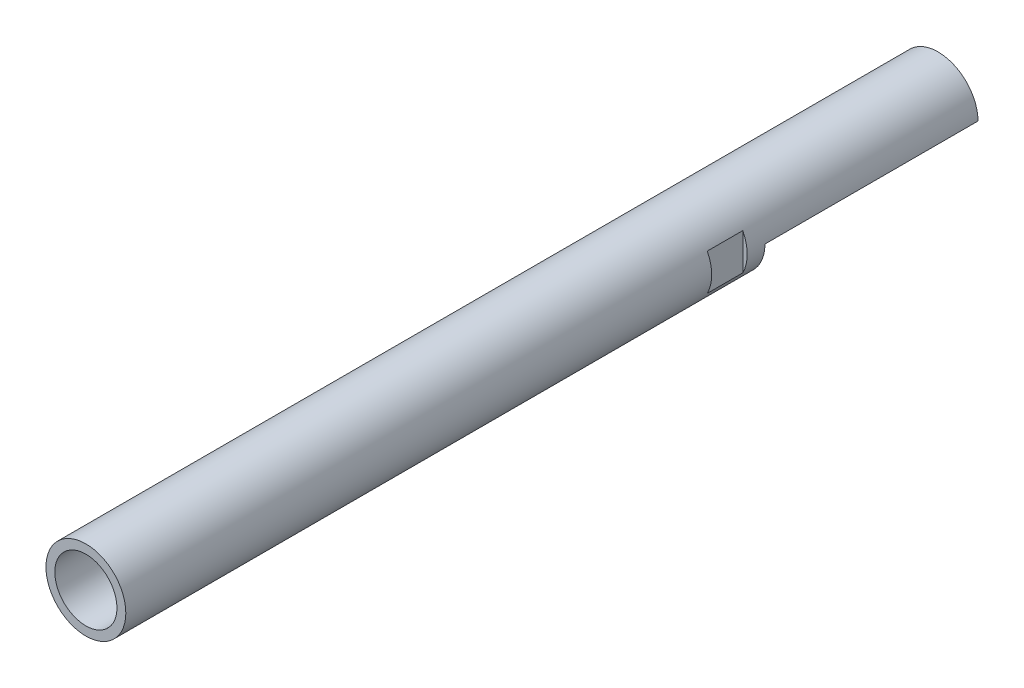
from build123d import *

# Parameters (mm, degrees)
SKETCH1_R                           = 14.2875
SKETCH1_R_2                         = 9.525
BOSS_EXTRUDE1_DEPTH                 = 304.8
SKETCH2_R                           = 11.1125
CUT_EXTRUDE1_DEPTH                  = 19.05
CUT_EXTRUDE4_DEPTH                  = 76.2
CUT_EXTRUDE7_DEPTH                  = 12.7
CUT_EXTRUDE8_REACH                  = 308.326
CUT_EXTRUDE8_END_RADIUS             = 9.525
CUT_EXTRUDE8_DIRECTION_2_REACH      = 308.326
CUT_EXTRUDE8_DIRECTION_2_END_RADIUS = 14.2875


with BuildPart() as part:
    # Sketch1 → Boss-Extrude1 (new body)
    with BuildSketch(Plane.XY):
        with Locations(Location((0, 0, 0), (0, 0, 180))):
            Circle(SKETCH1_R)
        with Locations(Location((0, 0, 0), (0, 0, 180))):
            Circle(SKETCH1_R_2, mode=Mode.SUBTRACT)
    extrude(amount=BOSS_EXTRUDE1_DEPTH)

    # Sketch2 → Cut-Extrude1 (cut)
    with BuildSketch(Plane.XY.offset(304.8)):
        Circle(SKETCH2_R)
    extrude(amount=-CUT_EXTRUDE1_DEPTH, mode=Mode.SUBTRACT)

    # Sketch6 → Cut-Extrude4 (cut)
    with BuildSketch(Plane(origin=(0, 0, 0), x_dir=(-1, 0, 0), z_dir=(0, 0, -1))):
        with BuildLine():
            Line((14.2875, 0), (-14.2875, 0))
            ThreePointArc((-14.2875, 0), (0, -14.2875), (14.2875, 0))
        make_face()
    extrude(amount=-CUT_EXTRUDE4_DEPTH, mode=Mode.SUBTRACT)

    # Sketch8 → Cut-Extrude7 (cut)
    with BuildSketch(Plane(origin=(0, 0, 82.55), x_dir=(-1, 0, 0), z_dir=(0, 0, -1))):
        with BuildLine():
            ThreePointArc((-6.545430181, -12.7), (0, -14.2875), (6.545430181, -12.7))
            Line((6.545430181, -12.7), (-6.545430181, -12.7))
        make_face()
        with BuildLine():
            Line((-12.7, -6.545430181), (-12.7, 6.545430181))
            ThreePointArc((-12.7, 6.545430181), (-14.2875, 0), (-12.7, -6.545430181))
        make_face()
    extrude(amount=-CUT_EXTRUDE7_DEPTH, mode=Mode.SUBTRACT)

    # Cut-Extrude8: up to this cylinder (the profile starts outside it)
    cut_extrude8_end = Plane(origin=(0, 0, 171.45), z_dir=(0, 0, -1)) * Cylinder(CUT_EXTRUDE8_END_RADIUS, 636.702, mode=Mode.PRIVATE)
    # Sketch9 → Cut-Extrude8 (cut, up to the surface)
    with BuildSketch(Plane.XZ.offset(12.7), mode=Mode.PRIVATE) as cut_extrude8_sk1:
        with BuildLine():
            ThreePointArc((0, 174.625), (-3.175, 171.45), (0, 168.275))
            Line((0, 168.275), (0, 174.625))
        make_face()
    cut_extrude8_tool1 = extrude(cut_extrude8_sk1.sketch, amount=-CUT_EXTRUDE8_REACH, mode=Mode.PRIVATE) - cut_extrude8_end
    add(cut_extrude8_tool1.solids().sort_by_distance((-1.347512, -12.7, 171.45))[0], mode=Mode.SUBTRACT)
    # Sketch9 → Cut-Extrude8 (cut, up to the surface)
    with BuildSketch(Plane.XZ.offset(12.7), mode=Mode.PRIVATE) as cut_extrude8_sk2:
        with BuildLine():
            Line((0, 174.625), (0, 168.275))
            ThreePointArc((0, 168.275), (2.24506403, 169.20493597), (3.175, 171.45))
            ThreePointArc((3.175, 171.45), (2.24506403, 173.69506403), (0, 174.625))
        make_face()
    cut_extrude8_tool2 = extrude(cut_extrude8_sk2.sketch, amount=-CUT_EXTRUDE8_REACH, mode=Mode.PRIVATE) - cut_extrude8_end
    add(cut_extrude8_tool2.solids().sort_by_distance((1.347512, -12.7, 171.45))[0], mode=Mode.SUBTRACT)
    # Sketch9 → Cut-Extrude8 (cut, up to the surface)
    with BuildSketch(Plane.XZ.offset(12.7), mode=Mode.PRIVATE) as cut_extrude8_sk3:
        with BuildLine():
            ThreePointArc((0, 174.625), (-3.175, 171.45), (0, 168.275))
            Line((0, 168.275), (0, 174.625))
        make_face()
    cut_extrude8_tool3 = extrude(cut_extrude8_sk3.sketch, amount=-CUT_EXTRUDE8_REACH, mode=Mode.PRIVATE) - cut_extrude8_end
    add(cut_extrude8_tool3.solids().sort_by_distance((-1.347512, -12.7, 171.45))[0], mode=Mode.SUBTRACT)
    # Sketch9 → Cut-Extrude8 (cut, up to the surface)
    with BuildSketch(Plane.XZ.offset(12.7), mode=Mode.PRIVATE) as cut_extrude8_sk4:
        with BuildLine():
            Line((0, 174.625), (0, 168.275))
            ThreePointArc((0, 168.275), (2.24506403, 169.20493597), (3.175, 171.45))
            ThreePointArc((3.175, 171.45), (2.24506403, 173.69506403), (0, 174.625))
        make_face()
    cut_extrude8_tool4 = extrude(cut_extrude8_sk4.sketch, amount=-CUT_EXTRUDE8_REACH, mode=Mode.PRIVATE) - cut_extrude8_end
    add(cut_extrude8_tool4.solids().sort_by_distance((1.347512, -12.7, 171.45))[0], mode=Mode.SUBTRACT)

    # Cut-Extrude8 direction 2: up to this cylinder (the profile starts inside it)
    cut_extrude8_direction_2_end = Plane(origin=(0, 0, 171.45), z_dir=(0, 0, -1)) * Cylinder(CUT_EXTRUDE8_DIRECTION_2_END_RADIUS, 646.227, mode=Mode.PRIVATE)
    # Sketch9 → Cut-Extrude8 direction 2 (cut, up to the surface)
    with BuildSketch(Plane.XZ.offset(12.7), mode=Mode.PRIVATE) as cut_extrude8_direction_2_sk1:
        with BuildLine():
            ThreePointArc((0, 174.625), (-3.175, 171.45), (0, 168.275))
            Line((0, 168.275), (0, 174.625))
        make_face()
    cut_extrude8_direction_2_tool1 = extrude(cut_extrude8_direction_2_sk1.sketch, amount=CUT_EXTRUDE8_DIRECTION_2_REACH, mode=Mode.PRIVATE) & cut_extrude8_direction_2_end
    add(cut_extrude8_direction_2_tool1.solids().sort_by_distance((-1.347512, -12.7, 171.45))[0], mode=Mode.SUBTRACT)
    # Sketch9 → Cut-Extrude8 direction 2 (cut, up to the surface)
    with BuildSketch(Plane.XZ.offset(12.7), mode=Mode.PRIVATE) as cut_extrude8_direction_2_sk2:
        with BuildLine():
            Line((0, 174.625), (0, 168.275))
            ThreePointArc((0, 168.275), (2.24506403, 169.20493597), (3.175, 171.45))
            ThreePointArc((3.175, 171.45), (2.24506403, 173.69506403), (0, 174.625))
        make_face()
    cut_extrude8_direction_2_tool2 = extrude(cut_extrude8_direction_2_sk2.sketch, amount=CUT_EXTRUDE8_DIRECTION_2_REACH, mode=Mode.PRIVATE) & cut_extrude8_direction_2_end
    add(cut_extrude8_direction_2_tool2.solids().sort_by_distance((1.347512, -12.7, 171.45))[0], mode=Mode.SUBTRACT)
    # Sketch9 → Cut-Extrude8 direction 2 (cut, up to the surface)
    with BuildSketch(Plane.XZ.offset(12.7), mode=Mode.PRIVATE) as cut_extrude8_direction_2_sk3:
        with BuildLine():
            ThreePointArc((0, 174.625), (-3.175, 171.45), (0, 168.275))
            Line((0, 168.275), (0, 174.625))
        make_face()
    cut_extrude8_direction_2_tool3 = extrude(cut_extrude8_direction_2_sk3.sketch, amount=CUT_EXTRUDE8_DIRECTION_2_REACH, mode=Mode.PRIVATE) & cut_extrude8_direction_2_end
    add(cut_extrude8_direction_2_tool3.solids().sort_by_distance((-1.347512, -12.7, 171.45))[0], mode=Mode.SUBTRACT)
    # Sketch9 → Cut-Extrude8 direction 2 (cut, up to the surface)
    with BuildSketch(Plane.XZ.offset(12.7), mode=Mode.PRIVATE) as cut_extrude8_direction_2_sk4:
        with BuildLine():
            Line((0, 174.625), (0, 168.275))
            ThreePointArc((0, 168.275), (2.24506403, 169.20493597), (3.175, 171.45))
            ThreePointArc((3.175, 171.45), (2.24506403, 173.69506403), (0, 174.625))
        make_face()
    cut_extrude8_direction_2_tool4 = extrude(cut_extrude8_direction_2_sk4.sketch, amount=CUT_EXTRUDE8_DIRECTION_2_REACH, mode=Mode.PRIVATE) & cut_extrude8_direction_2_end
    add(cut_extrude8_direction_2_tool4.solids().sort_by_distance((1.347512, -12.7, 171.45))[0], mode=Mode.SUBTRACT)


solid = part.part
